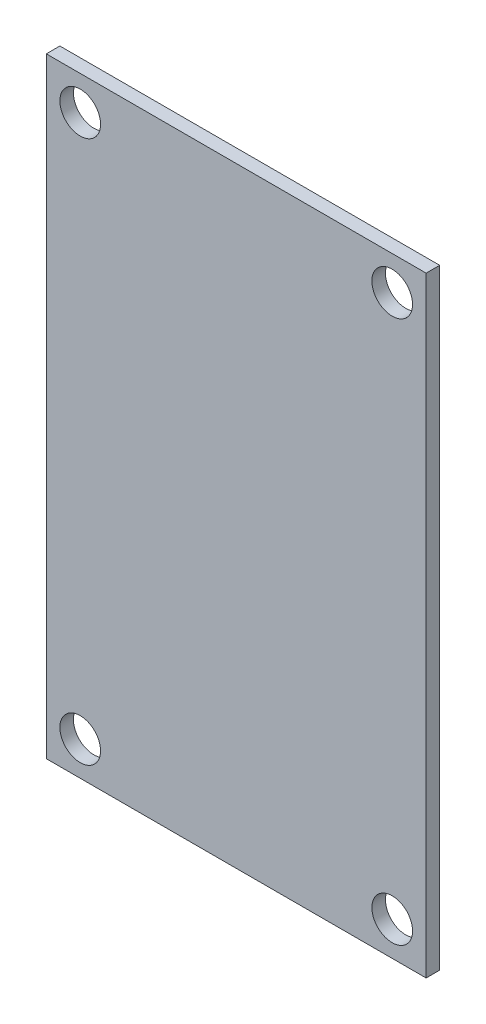
from build123d import *

# Parameters (mm, degrees)
CROQUIS1_W              = 28
CROQUIS1_H              = 45
SALIENTE_EXTRUIR1_DEPTH = 1
CROQUIS2_R              = 1.5
CORTAR_EXTRUIR1_DEPTH   = 54.009433123


with BuildPart() as part:
    # Croquis1 → Saliente-Extruir1 (new body)
    with BuildSketch(Plane.XY):
        with Locations((14, -22.5)):
            Rectangle(CROQUIS1_W, CROQUIS1_H)
    extrude(amount=SALIENTE_EXTRUIR1_DEPTH)

    # Croquis2 → Cortar-Extruir1 (cut, through all)
    with BuildSketch(Plane.XY.offset(1)):
        with Locations((2.5, -42.5)):
            Circle(CROQUIS2_R)
        with Locations(Location((2.5, -2.5, 0), (0, 0, 180))):
            Circle(CROQUIS2_R)
        with Locations(Location((25.5, -42.5, 0), (0, 0, 180))):
            Circle(CROQUIS2_R)
        with Locations((25.5, -2.5)):
            Circle(CROQUIS2_R)
    extrude(amount=-CORTAR_EXTRUIR1_DEPTH, mode=Mode.SUBTRACT)


solid = part.part
